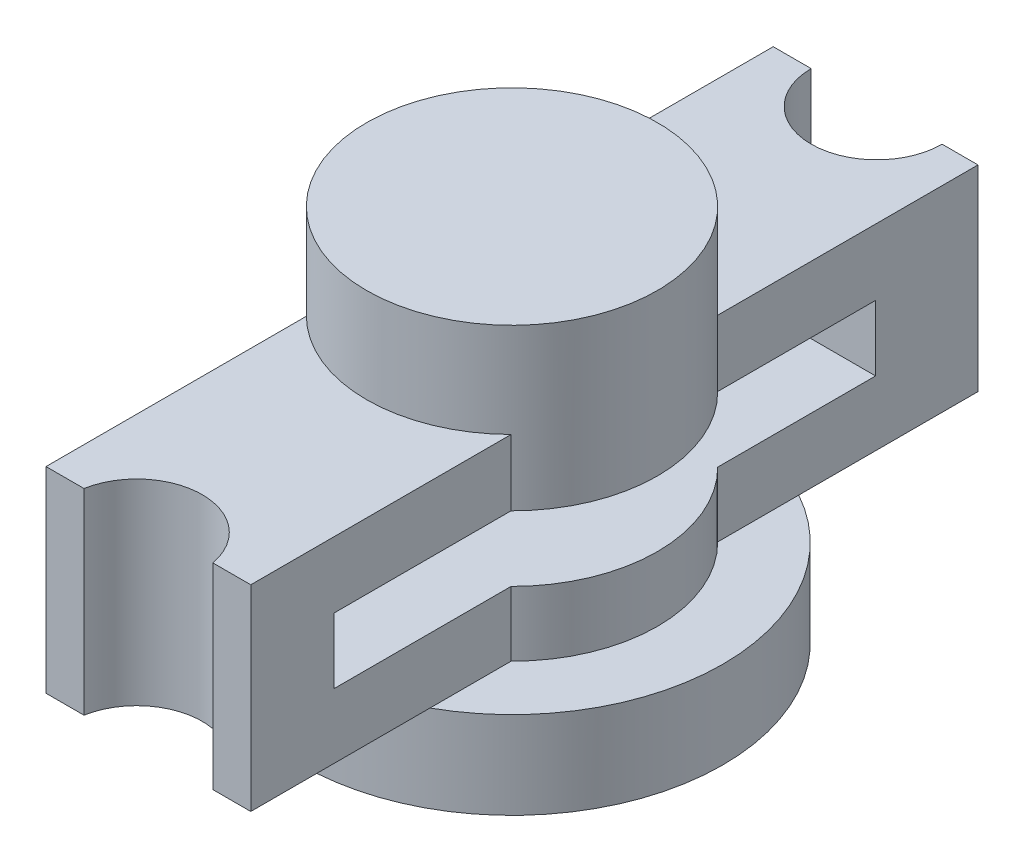
from build123d import *

# Parameters (mm, degrees)
SKETCH1_R           = 20
BOSS_EXTRUDE1_DEPTH = 52
SKETCH2_R           = 29
BOSS_EXTRUDE2_DEPTH = 12
BOSS_EXTRUDE3_DEPTH = 27
CUT_EXTRUDE1_DEPTH  = 93.503464219
SKETCH8_W           = 28.411423822
SKETCH8_H           = 9
CUT_EXTRUDE2_DEPTH  = 26
SKETCH9_R           = 20.095724015
CUT_EXTRUDE3_DEPTH  = 12


with BuildPart() as part:
    # Sketch1 → Boss-Extrude1 (new body)
    with BuildSketch(Plane(origin=(0, 0, 0), x_dir=(1, 0, 0), z_dir=(0, 1, 0))):
        with Locations(Location((0, 1.040702914, 0), (0, 0, 270))):
            Circle(SKETCH1_R)
    extrude(amount=-BOSS_EXTRUDE1_DEPTH)

    # Sketch2 → Boss-Extrude2 (add)
    with BuildSketch(Plane.XZ.offset(52)):
        with Locations(Location((0, -1.040702914, 0), (0, 0, 270))):
            Circle(SKETCH2_R)
    extrude(amount=BOSS_EXTRUDE2_DEPTH)

    # Sketch5 → Boss-Extrude3 (add)
    with BuildSketch(Plane(origin=(0, -52, 0), x_dir=(1, 0, 0), z_dir=(0, 1, 0))):
        with BuildLine():
            Line((14.078272234, -13.165008997), (-14.078272234, -13.165008997))
            Line((-14.078272234, -13.165008997), (-14.078272234, -48.959297086))
            Line((-14.078272234, -48.959297086), (-8.855775068, -48.959297086))
            ThreePointArc((-8.855775068, -48.959297086), (0.001248583, -41.557149408), (8.858272234, -48.959297086))
            Line((8.858272234, -48.959297086), (14.078272234, -48.959297086))
            Line((14.078272234, -48.959297086), (14.078272234, -13.165008997))
        make_face()
        with BuildLine():
            Line((-14.078272234, 51.040702914), (-14.078272234, 15.246414825))
            Line((-14.078272234, 15.246414825), (14.078272234, 15.246414825))
            Line((14.078272234, 15.246414825), (14.078272234, 51.040702914))
            Line((14.078272234, 51.040702914), (9.144224932, 51.040702914))
            ThreePointArc((9.144224932, 51.040702914), (0.144224932, 42.040702914), (-8.855775068, 51.040702914))
            Line((-8.855775068, 51.040702914), (-14.078272234, 51.040702914))
        make_face()
    extrude(amount=BOSS_EXTRUDE3_DEPTH)

    # Sketch6 → Cut-Extrude1 (cut, through all)
    with BuildSketch(Plane(origin=(14.078272234, 0, 0), x_dir=(0, 0, -1), z_dir=(1, 0, 0))):
        Polygon((-13.165008997, -34.09107024), (-37.484236428, -34.09107024), (-37.484236428, -43.09107024), (36.957800208, -43.09107024), (36.957800208, -34.09107024), align=None)
    extrude(amount=-CUT_EXTRUDE1_DEPTH, mode=Mode.SUBTRACT)

    # Sketch8 → Cut-Extrude2 (cut, symmetric)
    with BuildSketch(Plane(origin=(0, 0, 0), x_dir=(0, 0, -1), z_dir=(1, 0, 0))):
        with Locations((1.040702914, -38.59107024)):
            Rectangle(SKETCH8_W, SKETCH8_H)
    extrude(amount=CUT_EXTRUDE2_DEPTH, both=True, mode=Mode.SUBTRACT)

    # Sketch9 → Cut-Extrude3 (cut)
    with BuildSketch(Plane(origin=(0, 0, 0), x_dir=(1, 0, 0), z_dir=(0, 1, 0))):
        with Locations((0, 1.040702914)):
            Circle(SKETCH9_R)
    extrude(amount=-CUT_EXTRUDE3_DEPTH, mode=Mode.SUBTRACT)


solid = part.part
